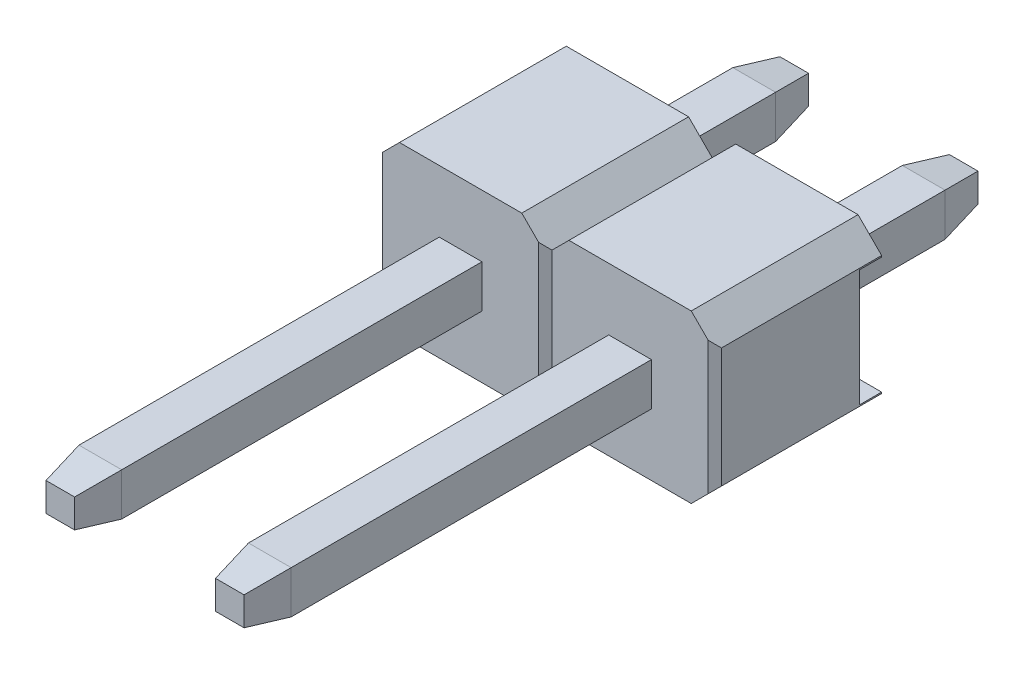
from build123d import *
from OCP.BRepFilletAPI import BRepFilletAPI_MakeChamfer

# Parameters (mm, degrees)
EXTRUDE1_DEPTH              = 1.25
CUT_EXTRUDE3_DEPTH          = 3.176671771
LPATTERN4_COUNT             = 2
LPATTERN4_PITCH             = 2.54
CUT_EXTRUDE1_DEPTH          = 5.20013095
CUT_EXTRUDE1_DEPTH_BACK     = 5.20013095
SKETCH2_W                   = 1.752893218
SKETCH2_H                   = 0.33
SKETCH3_W                   = 11
SKETCH3_H                   = 0.64
EXTRUDE_THIN1_DEPTH         = 0.32
CHAMFER2_SIZE               = 0.6
CHAMFER2_SIZE2              = 0.105796188
LPATTERN5_COUNT             = 2
LPATTERN5_PITCH             = 2.54
CHAMFER2_OF_LPATTERN5_SIZE  = 0.6
CHAMFER2_OF_LPATTERN5_SIZE2 = 0.105796188


with BuildPart() as part:
    # Sketch1 → Extrude1 (new, symmetric)
    with BuildSketch(Plane.XY):
        Polygon((-1.27, 0.896446609), (-0.916446609, 1.25), (0.916446609, 1.25), (1.27, 0.896446609), (1.27, -0.896446609), (0.916446609, -1.25), (-0.916446609, -1.25), (-1.27, -0.896446609), align=None)
    extrude1 = extrude(amount=EXTRUDE1_DEPTH, both=True)

    # Sketch4 → Cut-Extrude3 (cut, symmetric)
    with BuildSketch(Plane(origin=(0, 0, 0), x_dir=(1, 0, 0), z_dir=(0, 1, 0))):
        Polygon((-1.27, -1.15), (-1.17, -1.25), (-1.27, -1.25), align=None)
        Polygon((1.17, -1.25), (1.27, -1.15), (1.27, -1.25), align=None)
    cut_extrude3 = extrude(amount=CUT_EXTRUDE3_DEPTH, both=True, mode=Mode.SUBTRACT)

    # LPattern4: Extrude1, Cut-Extrude3 ×2
    with Locations(*[(-i * LPATTERN4_PITCH, 0, 0) for i in range(1, LPATTERN4_COUNT)]):
        add(extrude1)
        add(cut_extrude3, mode=Mode.SUBTRACT)

    # Sketch2 → Cut-Extrude1 (cut, two sides: drawn at the far end of the back side and taken through both)
    with BuildSketch(Plane(origin=(0, 0, 0), x_dir=(0, -1, 0), z_dir=(1, 0, 0)).offset(-CUT_EXTRUDE1_DEPTH_BACK)):
        with Locations((0, 1.085)):
            Rectangle(SKETCH2_W, SKETCH2_H)
    extrude(amount=CUT_EXTRUDE1_DEPTH + CUT_EXTRUDE1_DEPTH_BACK, mode=Mode.SUBTRACT)

    # Sketch3 → Extrude-Thin1 (add, symmetric)
    with BuildSketch(Plane(origin=(0, 0, 0), x_dir=(0, 0, -1), z_dir=(1, 0, 0))):
        with Locations((-1.75, 0)):
            Rectangle(SKETCH3_W, SKETCH3_H)
    extrude_thin1 = extrude(amount=EXTRUDE_THIN1_DEPTH, both=True)

    # Chamfer2: one chamfer whose edges measure the first distance from different faces: ONE call of the kernel's chamfer builder (chamfer() names one face for all edges)
    chamfer2_edges_1 = [part.edges().sort_by_distance(p)[0] for p in [
        (0.32, 0, 7.25),
    ]]
    chamfer2_side_1 = [part.faces().sort_by_distance(p)[0] for p in [
        (0.32, 0, 4.25),
    ]]
    chamfer2_edges_2 = [part.edges().sort_by_distance(p)[0] for p in [
        (0, -0.32, 7.25),
    ]]
    chamfer2_side_2 = [part.faces().sort_by_distance(p)[0] for p in [
        (0, -0.32, 4.25),
    ]]
    chamfer2_edges_3 = [part.edges().sort_by_distance(p)[0] for p in [
        (-0.32, 0, 7.25),
    ]]
    chamfer2_side_3 = [part.faces().sort_by_distance(p)[0] for p in [
        (-0.32, 0, 4.25),
    ]]
    chamfer2_edges_4 = [part.edges().sort_by_distance(p)[0] for p in [
        (0, 0.32, 7.25),
    ]]
    chamfer2_side_4 = [part.faces().sort_by_distance(p)[0] for p in [
        (0, 0.32, 4.25),
    ]]
    chamfer2_edges_5 = [part.edges().sort_by_distance(p)[0] for p in [
        (0.32, 0, -3.75),
    ]]
    chamfer2_side_5 = [part.faces().sort_by_distance(p)[0] for p in [
        (0.32, 0, -2.335),
    ]]
    chamfer2_edges_6 = [part.edges().sort_by_distance(p)[0] for p in [
        (-0.32, 0, -3.75),
    ]]
    chamfer2_side_6 = [part.faces().sort_by_distance(p)[0] for p in [
        (-0.32, 0, -2.335),
    ]]
    chamfer2_edges_7 = [part.edges().sort_by_distance(p)[0] for p in [
        (0, 0.32, -3.75),
    ]]
    chamfer2_side_7 = [part.faces().sort_by_distance(p)[0] for p in [
        (0, 0.32, -2.335),
    ]]
    chamfer2_edges_8 = [part.edges().sort_by_distance(p)[0] for p in [
        (0, -0.32, -3.75),
    ]]
    chamfer2_side_8 = [part.faces().sort_by_distance(p)[0] for p in [
        (0, -0.32, -2.335),
    ]]
    chamfer2 = BRepFilletAPI_MakeChamfer(part.part.solid().wrapped)
    for e in chamfer2_edges_1:
        chamfer2.Add(CHAMFER2_SIZE, CHAMFER2_SIZE2, e.wrapped, chamfer2_side_1[0].wrapped)  # the first distance lies on this face
    for e in chamfer2_edges_2:
        chamfer2.Add(CHAMFER2_SIZE, CHAMFER2_SIZE2, e.wrapped, chamfer2_side_2[0].wrapped)  # the first distance lies on this face
    for e in chamfer2_edges_3:
        chamfer2.Add(CHAMFER2_SIZE, CHAMFER2_SIZE2, e.wrapped, chamfer2_side_3[0].wrapped)  # the first distance lies on this face
    for e in chamfer2_edges_4:
        chamfer2.Add(CHAMFER2_SIZE, CHAMFER2_SIZE2, e.wrapped, chamfer2_side_4[0].wrapped)  # the first distance lies on this face
    for e in chamfer2_edges_5:
        chamfer2.Add(CHAMFER2_SIZE, CHAMFER2_SIZE2, e.wrapped, chamfer2_side_5[0].wrapped)  # the first distance lies on this face
    for e in chamfer2_edges_6:
        chamfer2.Add(CHAMFER2_SIZE, CHAMFER2_SIZE2, e.wrapped, chamfer2_side_6[0].wrapped)  # the first distance lies on this face
    for e in chamfer2_edges_7:
        chamfer2.Add(CHAMFER2_SIZE, CHAMFER2_SIZE2, e.wrapped, chamfer2_side_7[0].wrapped)  # the first distance lies on this face
    for e in chamfer2_edges_8:
        chamfer2.Add(CHAMFER2_SIZE, CHAMFER2_SIZE2, e.wrapped, chamfer2_side_8[0].wrapped)  # the first distance lies on this face
    add(Compound.cast(chamfer2.Shape()), mode=Mode.REPLACE)

    # LPattern5: Extrude-Thin1 ×2
    with Locations(*[(-i * LPATTERN5_PITCH, 0, 0) for i in range(1, LPATTERN5_COUNT)]):
        add(extrude_thin1)

    # Chamfer2 of LPattern5: one chamfer whose edges measure the first distance from different faces: ONE call of the kernel's chamfer builder (chamfer() names one face for all edges)
    chamfer2_of_lpattern5_edges_1 = [part.edges().sort_by_distance(p)[0] for p in [
        (-2.22, 0, 7.25),
    ]]
    chamfer2_of_lpattern5_side_1 = [part.faces().sort_by_distance(p)[0] for p in [
        (-2.22, 0, 4.25),
    ]]
    chamfer2_of_lpattern5_edges_2 = [part.edges().sort_by_distance(p)[0] for p in [
        (-2.54, -0.32, 7.25),
    ]]
    chamfer2_of_lpattern5_side_2 = [part.faces().sort_by_distance(p)[0] for p in [
        (-2.54, -0.32, 4.25),
    ]]
    chamfer2_of_lpattern5_edges_3 = [part.edges().sort_by_distance(p)[0] for p in [
        (-2.86, 0, 7.25),
    ]]
    chamfer2_of_lpattern5_side_3 = [part.faces().sort_by_distance(p)[0] for p in [
        (-2.86, 0, 4.25),
    ]]
    chamfer2_of_lpattern5_edges_4 = [part.edges().sort_by_distance(p)[0] for p in [
        (-2.54, 0.32, 7.25),
    ]]
    chamfer2_of_lpattern5_side_4 = [part.faces().sort_by_distance(p)[0] for p in [
        (-2.54, 0.32, 4.25),
    ]]
    chamfer2_of_lpattern5_edges_5 = [part.edges().sort_by_distance(p)[0] for p in [
        (-2.22, 0, -3.75),
    ]]
    chamfer2_of_lpattern5_side_5 = [part.faces().sort_by_distance(p)[0] for p in [
        (-2.22, 0, -2.335),
    ]]
    chamfer2_of_lpattern5_edges_6 = [part.edges().sort_by_distance(p)[0] for p in [
        (-2.86, 0, -3.75),
    ]]
    chamfer2_of_lpattern5_side_6 = [part.faces().sort_by_distance(p)[0] for p in [
        (-2.86, 0, -2.335),
    ]]
    chamfer2_of_lpattern5_edges_7 = [part.edges().sort_by_distance(p)[0] for p in [
        (-2.54, 0.32, -3.75),
    ]]
    chamfer2_of_lpattern5_side_7 = [part.faces().sort_by_distance(p)[0] for p in [
        (-2.54, 0.32, -2.335),
    ]]
    chamfer2_of_lpattern5_edges_8 = [part.edges().sort_by_distance(p)[0] for p in [
        (-2.54, -0.32, -3.75),
    ]]
    chamfer2_of_lpattern5_side_8 = [part.faces().sort_by_distance(p)[0] for p in [
        (-2.54, -0.32, -2.335),
    ]]
    chamfer2_of_lpattern5 = BRepFilletAPI_MakeChamfer(part.part.solid().wrapped)
    for e in chamfer2_of_lpattern5_edges_1:
        chamfer2_of_lpattern5.Add(CHAMFER2_OF_LPATTERN5_SIZE, CHAMFER2_OF_LPATTERN5_SIZE2, e.wrapped, chamfer2_of_lpattern5_side_1[0].wrapped)  # the first distance lies on this face
    for e in chamfer2_of_lpattern5_edges_2:
        chamfer2_of_lpattern5.Add(CHAMFER2_OF_LPATTERN5_SIZE, CHAMFER2_OF_LPATTERN5_SIZE2, e.wrapped, chamfer2_of_lpattern5_side_2[0].wrapped)  # the first distance lies on this face
    for e in chamfer2_of_lpattern5_edges_3:
        chamfer2_of_lpattern5.Add(CHAMFER2_OF_LPATTERN5_SIZE, CHAMFER2_OF_LPATTERN5_SIZE2, e.wrapped, chamfer2_of_lpattern5_side_3[0].wrapped)  # the first distance lies on this face
    for e in chamfer2_of_lpattern5_edges_4:
        chamfer2_of_lpattern5.Add(CHAMFER2_OF_LPATTERN5_SIZE, CHAMFER2_OF_LPATTERN5_SIZE2, e.wrapped, chamfer2_of_lpattern5_side_4[0].wrapped)  # the first distance lies on this face
    for e in chamfer2_of_lpattern5_edges_5:
        chamfer2_of_lpattern5.Add(CHAMFER2_OF_LPATTERN5_SIZE, CHAMFER2_OF_LPATTERN5_SIZE2, e.wrapped, chamfer2_of_lpattern5_side_5[0].wrapped)  # the first distance lies on this face
    for e in chamfer2_of_lpattern5_edges_6:
        chamfer2_of_lpattern5.Add(CHAMFER2_OF_LPATTERN5_SIZE, CHAMFER2_OF_LPATTERN5_SIZE2, e.wrapped, chamfer2_of_lpattern5_side_6[0].wrapped)  # the first distance lies on this face
    for e in chamfer2_of_lpattern5_edges_7:
        chamfer2_of_lpattern5.Add(CHAMFER2_OF_LPATTERN5_SIZE, CHAMFER2_OF_LPATTERN5_SIZE2, e.wrapped, chamfer2_of_lpattern5_side_7[0].wrapped)  # the first distance lies on this face
    for e in chamfer2_of_lpattern5_edges_8:
        chamfer2_of_lpattern5.Add(CHAMFER2_OF_LPATTERN5_SIZE, CHAMFER2_OF_LPATTERN5_SIZE2, e.wrapped, chamfer2_of_lpattern5_side_8[0].wrapped)  # the first distance lies on this face
    add(Compound.cast(chamfer2_of_lpattern5.Shape()), mode=Mode.REPLACE)


solid = part.part
